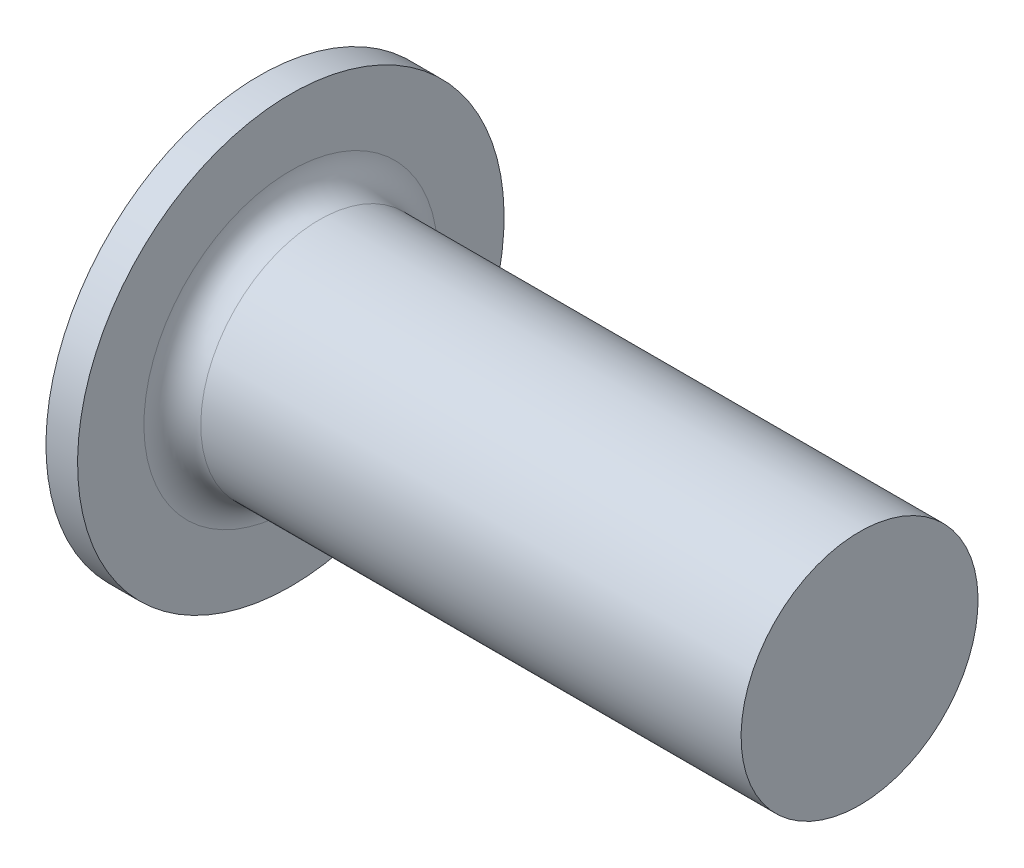
from build123d import *

# Parameters (mm, degrees)
CUT_EXTRUDE1_DEPTH = 1
FILLET1_R          = 0.6


with BuildPart() as part:
    # Sketch1 → Revolve1 (revolve)
    with BuildSketch(Plane.XY):
        Polygon((0, 2.5), (12, 2.5), (12, 0), (-1, 0), (-1, 3.922649731), (-0.666666667, 4.5), (0, 4.5), align=None)
    revolve(axis=Axis((-1, 0, 0), (1, 0, 0)))

    # Sketch2 → Cut-Extrude1 (cut)
    with BuildSketch(Plane(origin=(-1, 0, 0), x_dir=(0, 0, -1), z_dir=(1, 0, 0))):
        with BuildLine():
            ThreePointArc((0.268841336, 1.198258139), (0, 1.4), (-0.268841336, 1.198258139))
            ThreePointArc((-0.268841336, 1.198258139), (-0.5125, 0.887676039), (-0.903301321, 0.831952496))
            ThreePointArc((-0.903301321, 0.831952496), (-1.212435565, 0.7), (-1.172142656, 0.366305643))
            ThreePointArc((-1.172142656, 0.366305643), (-1.025, 0), (-1.172142656, -0.366305643))
            ThreePointArc((-1.172142656, -0.366305643), (-1.212435565, -0.7), (-0.903301321, -0.831952496))
            ThreePointArc((-0.903301321, -0.831952496), (-0.5125, -0.887676039), (-0.268841336, -1.198258139))
            ThreePointArc((-0.268841336, -1.198258139), (0, -1.4), (0.268841336, -1.198258139))
            ThreePointArc((0.268841336, -1.198258139), (0.5125, -0.887676039), (0.903301321, -0.831952496))
            ThreePointArc((0.903301321, -0.831952496), (1.212435565, -0.7), (1.172142656, -0.366305643))
            ThreePointArc((1.172142656, -0.366305643), (1.025, 0), (1.172142656, 0.366305643))
            ThreePointArc((1.172142656, 0.366305643), (1.212435565, 0.7), (0.903301321, 0.831952496))
            ThreePointArc((0.903301321, 0.831952496), (0.5125, 0.887676039), (0.268841336, 1.198258139))
        make_face()
    extrude(amount=CUT_EXTRUDE1_DEPTH, mode=Mode.SUBTRACT)

    # Fillet1
    fillet1_edges = [part.edges().sort_by_distance(p)[0] for p in [
        (0, -2.5, 0),
    ]]
    fillet(fillet1_edges, radius=FILLET1_R)


solid = part.part
